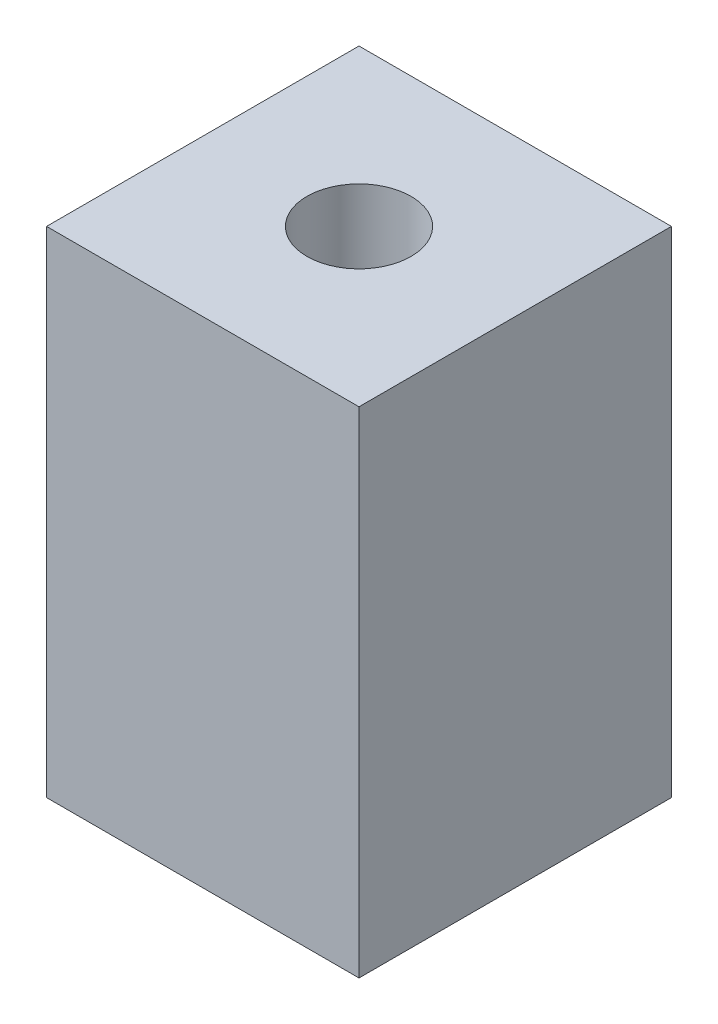
from build123d import *

# Parameters (mm, degrees)
SKETCH1_W           = 12
SKETCH1_H           = 12
SKETCH1_R           = 2
BOSS_EXTRUDE1_DEPTH = 19


with BuildPart() as part:
    # Sketch1 → Boss-Extrude1 (new body)
    with BuildSketch(Plane(origin=(0, 0, 0), x_dir=(1, 0, 0), z_dir=(0, 1, 0))):
        Rectangle(SKETCH1_W, SKETCH1_H)
        with Locations(Location((0, 0, 0), (0, 0, 270))):
            Circle(SKETCH1_R, mode=Mode.SUBTRACT)
    extrude(amount=BOSS_EXTRUDE1_DEPTH)


solid = part.part
